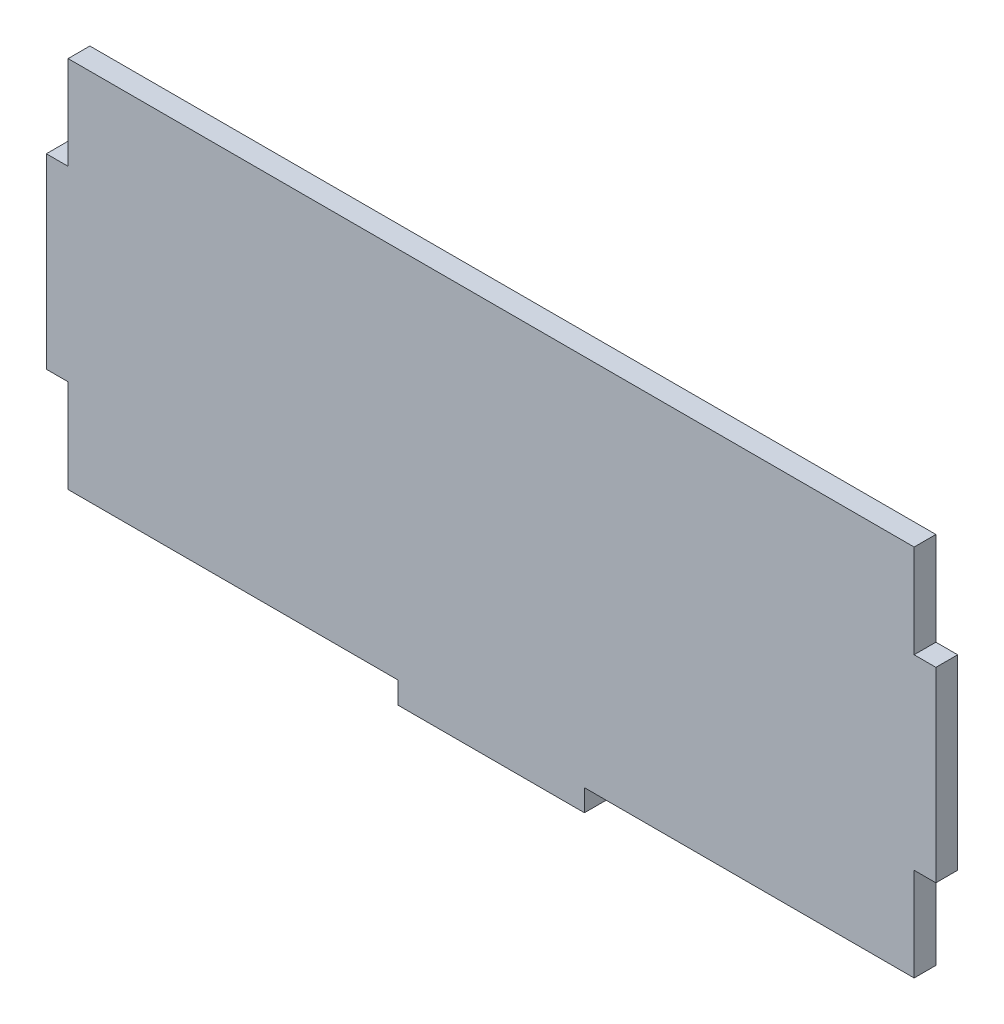
from build123d import *

# Parameters (mm, degrees)
SKETCH_1_W      = 136
SKETCH_1_H      = 60
SKETCH_1_W_2    = 3.5
SKETCH_1_H_2    = 30
SKETCH_1_W_3    = 30
SKETCH_1_H_3    = 3.5
EXTRUDE_1_DEPTH = 3.5


with BuildPart() as part:
    # Эскиз1 → Бобышка-Вытянуть1 (new body)
    with BuildSketch(Plane.XY):
        with Locations((68, 30)):
            Rectangle(SKETCH_1_W, SKETCH_1_H)
        with Locations((-1.75, 30)):
            Rectangle(SKETCH_1_W_2, SKETCH_1_H_2)
        with Locations((137.75, 30)):
            Rectangle(SKETCH_1_W_2, SKETCH_1_H_2)
        with Locations((68, -1.75)):
            Rectangle(SKETCH_1_W_3, SKETCH_1_H_3)
    extrude(amount=EXTRUDE_1_DEPTH)


solid = part.part
